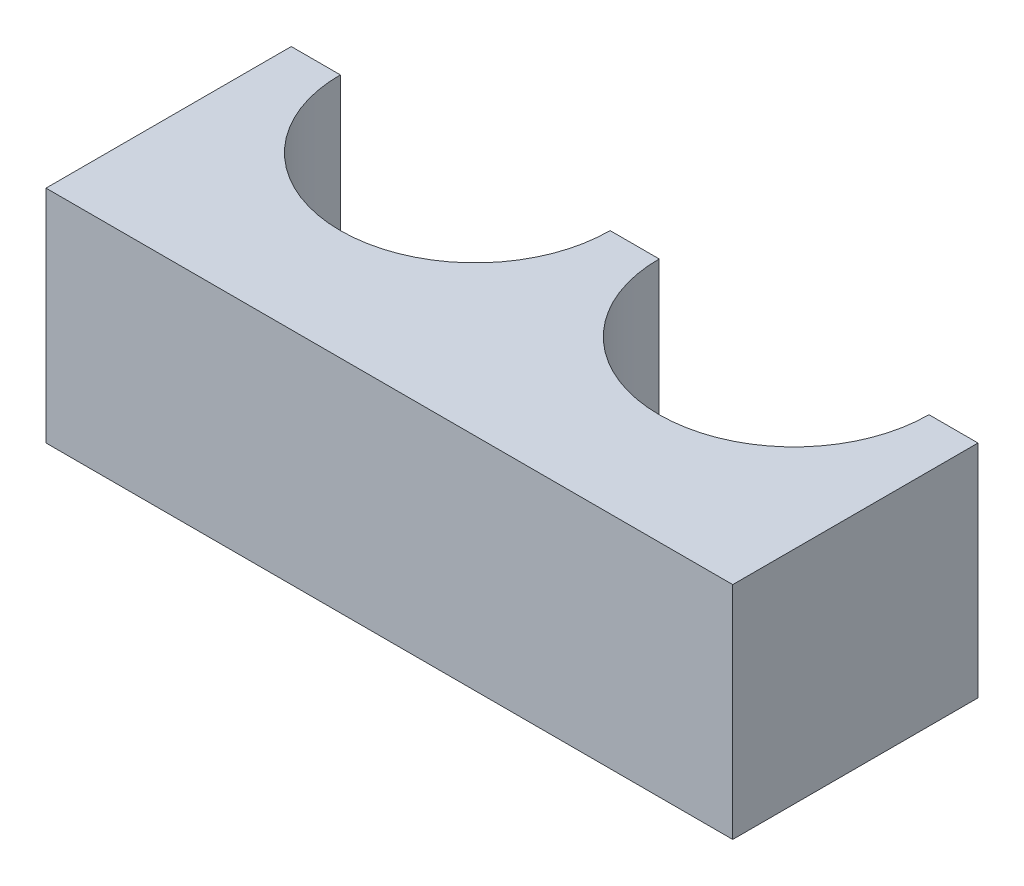
from build123d import *

# Parameters (mm, degrees)
SKETCH1_W           = 28000
SKETCH1_H           = 9000
BOSS_EXTRUDE1_DEPTH = 10000
CUT_EXTRUDE1_REACH  = 19418.488


with BuildPart() as part:
    # Sketch1 → Boss-Extrude1 (new body)
    with BuildSketch(Plane.XY):
        Rectangle(SKETCH1_W, SKETCH1_H)
    extrude(amount=BOSS_EXTRUDE1_DEPTH)

    # Sketch2 → Cut-Extrude1 (cut, up to next)
    with BuildSketch(Plane.XZ.offset(4500), mode=Mode.PRIVATE) as cut_extrude1_sk1:
        with BuildLine():
            Line((-12000, 0), (-1000, 0))
            ThreePointArc((-1000, 0), (-6500, 5500), (-12000, 0))
        make_face()
    cut_extrude1_tool1 = extrude(cut_extrude1_sk1.sketch, amount=-CUT_EXTRUDE1_REACH, mode=Mode.PRIVATE) & part.part
    # Sketch2 → Cut-Extrude1 (cut, up to next)
    with BuildSketch(Plane.XZ.offset(4500), mode=Mode.PRIVATE) as cut_extrude1_sk2:
        with BuildLine():
            Line((1000, 0), (12000, 0))
            ThreePointArc((12000, 0), (6500, 5500), (1000, 0))
        make_face()
    cut_extrude1_tool2 = extrude(cut_extrude1_sk2.sketch, amount=-CUT_EXTRUDE1_REACH, mode=Mode.PRIVATE) & part.part
    add(cut_extrude1_tool1.solids().sort_by_distance((-6500, -4500, 2334.272499))[0], mode=Mode.SUBTRACT)
    add(cut_extrude1_tool2.solids().sort_by_distance((6500, -4500, 2334.272499))[0], mode=Mode.SUBTRACT)


solid = part.part
